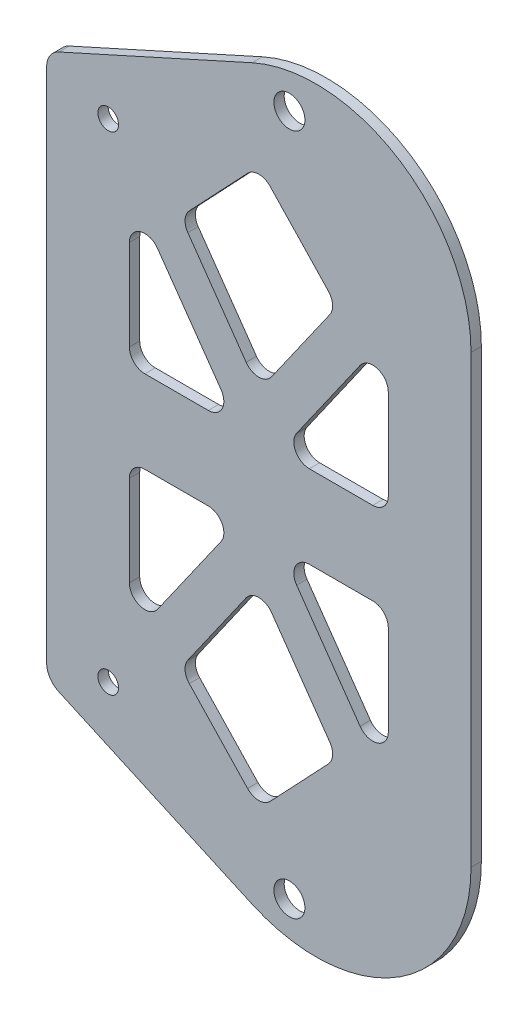
from build123d import *

# Parameters (mm, degrees)
CROQUIS3_R              = 1
CROQUIS3_R_2            = 1.500000006
CROQUIS3_R_3            = 1.000000012
CROQUIS3_R_4            = 1.5
SALIENTE_EXTRUIR1_DEPTH = 1
REDONDEO1_R             = 15
CORTAR_EXTRUIR1_DEPTH   = 1


with BuildPart() as part:
    # Croquis3 → Saliente-Extruir1 (new body)
    # profile 1 of 2: a face of its own
    with BuildSketch(Plane.XY):
        with BuildLine():
            Line((-11.943236247, 28.530474649), (-52.980665481, 28.530474649))
            Line((-52.980665481, 28.530474649), (-52.980665481, 3.561485174))
            ThreePointArc((-52.980665481, 3.561485174), (-52.660950937, 2.476754431), (-51.804024696, 1.738827882))
            Line((-51.804024696, 1.738827882), (-11.943236247, -16.267709961))
            Line((-11.943236247, -16.267709961), (-11.943236247, 28.530474649))
        make_face()
        with Locations((-47.027941845, 4.944189889)):
            Circle(CROQUIS3_R, mode=Mode.SUBTRACT)
        with Locations((-29.506723336, -4.454119513)):
            Circle(CROQUIS3_R_2, mode=Mode.SUBTRACT)
    # profile 2 of 2: a face of its own
    with BuildSketch(Plane.XY):
        with BuildLine():
            ThreePointArc((-51.804024696, 55.322121417), (-52.660950937, 54.584194868), (-52.980665481, 53.499464125))
            Line((-52.980665481, 53.499464125), (-52.980665481, 28.530474649))
            Line((-52.980665481, 28.530474649), (-11.943236247, 28.530474649))
            Line((-11.943236247, 28.530474649), (-11.943236247, 73.32865926))
            Line((-11.943236247, 73.32865926), (-51.804024696, 55.322121417))
        make_face()
        with Locations((-47.027941845, 52.116759452)):
            Circle(CROQUIS3_R_3, mode=Mode.SUBTRACT)
        with Locations((-29.506723336, 61.515068812)):
            Circle(CROQUIS3_R_4, mode=Mode.SUBTRACT)
    extrude(amount=SALIENTE_EXTRUIR1_DEPTH)

    # Redondeo1
    redondeo1_edges = [part.edges().sort_by_distance(p)[0] for p in [
        (-11.943236247, -16.267709961, 0.5),
        (-11.943236247, 73.32865926, 0.5),
    ]]
    fillet(redondeo1_edges, radius=REDONDEO1_R)

    # Croquis4 → Cortar-Extruir1 (cut)
    with BuildSketch(Plane.XY.offset(1)):
        with BuildLine():
            Line((-44.980665481, 34.030474649), (-44.980665481, 42.77886195))
            ThreePointArc((-44.980665481, 42.77886195), (-43.932223122, 44.209279965), (-42.252537885, 43.64008353))
            Line((-42.252537885, 43.64008353), (-36.117751927, 34.891696229))
            ThreePointArc((-36.117751927, 34.891696229), (-36.015121774, 33.338315841), (-37.345879522, 32.530474649))
            Line((-37.345879522, 32.530474649), (-43.480665481, 32.530474649))
            ThreePointArc((-43.480665481, 32.530474649), (-44.541325653, 32.969814478), (-44.980665481, 34.030474649))
        make_face()
        with BuildLine():
            Line((-22.671363843, 43.64008353), (-28.806149801, 34.891696229))
            ThreePointArc((-28.806149801, 34.891696229), (-28.908779954, 33.338315841), (-27.578022206, 32.530474649))
            Line((-27.578022206, 32.530474649), (-21.443236247, 32.530474649))
            ThreePointArc((-21.443236247, 32.530474649), (-20.382576076, 32.969814478), (-19.943236247, 34.030474649))
            Line((-19.943236247, 34.030474649), (-19.943236247, 42.77886195))
            ThreePointArc((-19.943236247, 42.77886195), (-20.991678606, 44.209279965), (-22.671363843, 43.64008353))
        make_face()
        with BuildLine():
            Line((-33.552014817, 54.287454199), (-39.187957869, 48.325271549))
            ThreePointArc((-39.187957869, 48.325271549), (-39.593914564, 47.404042805), (-39.326021512, 46.433632298))
            Line((-39.326021512, 46.433632298), (-33.69007846, 38.396609824))
            ThreePointArc((-33.69007846, 38.396609824), (-32.461950864, 37.757831403), (-31.233823268, 38.396609824))
            Line((-31.233823268, 38.396609824), (-25.597880217, 46.433632298))
            ThreePointArc((-25.597880217, 46.433632298), (-25.329987165, 47.404042805), (-25.735943859, 48.325271549))
            Line((-25.735943859, 48.325271549), (-31.371886911, 54.287454199))
            ThreePointArc((-31.371886911, 54.287454199), (-32.461950864, 54.757036527), (-33.552014817, 54.287454199))
        make_face()
        with BuildLine():
            Line((-31.371886911, 2.7734951), (-25.735943859, 8.73567775))
            ThreePointArc((-25.735943859, 8.73567775), (-25.329987165, 9.656906494), (-25.597880217, 10.627317001))
            Line((-25.597880217, 10.627317001), (-31.233823268, 18.664339475))
            ThreePointArc((-31.233823268, 18.664339475), (-32.461950864, 19.303117896), (-33.69007846, 18.664339475))
            Line((-33.69007846, 18.664339475), (-39.326021512, 10.627317001))
            ThreePointArc((-39.326021512, 10.627317001), (-39.593914564, 9.656906494), (-39.187957869, 8.73567775))
            Line((-39.187957869, 8.73567775), (-33.552014817, 2.7734951))
            ThreePointArc((-33.552014817, 2.7734951), (-32.461950864, 2.303912771), (-31.371886911, 2.7734951))
        make_face()
        with BuildLine():
            Line((-27.578022206, 24.530474649), (-21.443236247, 24.530474649))
            ThreePointArc((-21.443236247, 24.530474649), (-20.382576076, 24.091134821), (-19.943236247, 23.030474649))
            Line((-19.943236247, 23.030474649), (-19.943236247, 14.282087348))
            ThreePointArc((-19.943236247, 14.282087348), (-20.991678606, 12.851669334), (-22.671363843, 13.420865769))
            Line((-22.671363843, 13.420865769), (-28.806149801, 22.16925307))
            ThreePointArc((-28.806149801, 22.16925307), (-28.908779954, 23.722633457), (-27.578022206, 24.530474649))
        make_face()
        with BuildLine():
            Line((-37.345879522, 24.530474649), (-43.480665481, 24.530474649))
            ThreePointArc((-43.480665481, 24.530474649), (-44.541325653, 24.091134821), (-44.980665481, 23.030474649))
            Line((-44.980665481, 23.030474649), (-44.980665481, 14.282087348))
            ThreePointArc((-44.980665481, 14.282087348), (-43.932223122, 12.851669334), (-42.252537885, 13.420865769))
            Line((-42.252537885, 13.420865769), (-36.117751927, 22.16925307))
            ThreePointArc((-36.117751927, 22.16925307), (-36.015121774, 23.722633457), (-37.345879522, 24.530474649))
        make_face()
    extrude(amount=-CORTAR_EXTRUIR1_DEPTH, mode=Mode.SUBTRACT)


solid = part.part
